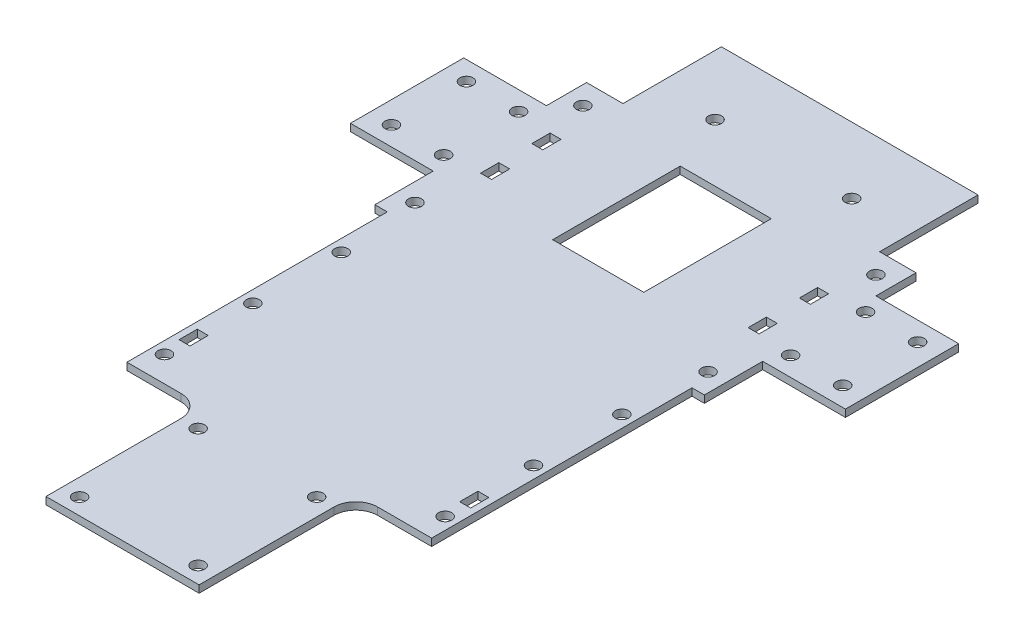
from build123d import *

# Parameters (mm, degrees)
SKETCH1_W            = 50
SKETCH1_H            = 9.1
BOSS_EXTRUDE1_DEPTH  = 2
SKETCH2_W            = 25
SKETCH2_H            = 6.6
CUT_EXTRUDE1_DEPTH   = 2
SKETCH3_R            = 1.8
CUT_EXTRUDE2_DEPTH   = 2
SKETCH4_W            = 66.4
SKETCH4_H            = 130
BOSS_EXTRUDE2_DEPTH  = 2
SKETCH5_W            = 66.4
SKETCH5_H            = 2
BOSS_EXTRUDE3_DEPTH  = 2.5
SKETCH6_W            = 8.6
SKETCH6_H            = 62.5
BOSS_EXTRUDE4_DEPTH  = 2
SKETCH7_R            = 1.8
SKETCH7_W            = 3
SKETCH7_H            = 5
CUT_EXTRUDE3_DEPTH   = 2
SKETCH8_W            = 25
SKETCH8_H            = 45
CUT_EXTRUDE4_DEPTH   = 20
SKETCH9_W            = 25
SKETCH9_H            = 10
BOSS_EXTRUDE5_DEPTH  = 2
SKETCH10_W           = 34.7
SKETCH10_H           = 27.07
BOSS_EXTRUDE6_DEPTH  = 2
SKETCH11_R           = 1.8
CUT_EXTRUDE5_DEPTH   = 2
SKETCH12_R           = 1.8
CUT_EXTRUDE6_DEPTH   = 2
SKETCH13_W           = 2
SKETCH13_H           = 2
BOSS_EXTRUDE7_DEPTH  = 44
SKETCH14_W           = 2
SKETCH14_H           = 2
BOSS_EXTRUDE8_DEPTH  = 46
SKETCH16_W           = 42
SKETCH16_H           = 43
BOSS_EXTRUDE10_DEPTH = 2
SKETCH18_R           = 1.8
CUT_EXTRUDE7_DEPTH   = 2
BOSS_EXTRUDE12_DEPTH = 2
SKETCH21_W           = 2
SKETCH21_H           = 2
BOSS_EXTRUDE13_DEPTH = 10
SKETCH25_W           = 3
SKETCH25_H           = 5
CUT_EXTRUDE8_DEPTH   = 10
SKETCH26_W           = 6.2
SKETCH26_H           = 13
SKETCH26_W_2         = 21
SKETCH26_H_2         = 6.6
BOSS_EXTRUDE14_DEPTH = 2
SKETCH27_W           = 2
SKETCH27_H           = 27
SKETCH27_H_2         = 24.93
BOSS_EXTRUDE15_DEPTH = 2
SKETCH29_W           = 10
SKETCH29_H           = 10
BOSS_EXTRUDE19_DEPTH = 2
SKETCH41_R           = 1.8
CUT_EXTRUDE15_DEPTH  = 2
BOSS_EXTRUDE26_DEPTH = 2
SKETCH43_W           = 70.4
SKETCH43_H           = 2
BOSS_EXTRUDE27_DEPTH = 11
SKETCH44_W           = 10
SKETCH44_H           = 5
BOSS_EXTRUDE28_DEPTH = 2
SKETCH45_R           = 1.8
BOSS_EXTRUDE29_DEPTH = 2
SKETCH46_R           = 1.8
CUT_EXTRUDE16_DEPTH  = 2
SKETCH47_W           = 10
SKETCH47_H           = 1
BOSS_EXTRUDE30_DEPTH = 2
SKETCH48_W           = 6.6
SKETCH48_H           = 8.93
BOSS_EXTRUDE31_DEPTH = 2


with BuildPart() as part:
    # Sketch1 → Boss-Extrude1 (new body)
    with BuildSketch(Plane(origin=(0, 0, 0), x_dir=(1, 0, 0), z_dir=(0, 1, 0))):
        with Locations((25, 4.55)):
            Rectangle(SKETCH1_W, SKETCH1_H)
    extrude(amount=BOSS_EXTRUDE1_DEPTH)

    # Sketch2 → Cut-Extrude1 (cut)
    with BuildSketch(Plane(origin=(0, 2, 0), x_dir=(1, 0, 0), z_dir=(0, 1, 0))):
        with Locations((25, 5.8)):
            Rectangle(SKETCH2_W, SKETCH2_H)
    extrude(amount=-CUT_EXTRUDE1_DEPTH, mode=Mode.SUBTRACT)

    # Sketch3 → Cut-Extrude2 (cut)
    with BuildSketch(Plane(origin=(0, 2, 0), x_dir=(1, 0, 0), z_dir=(0, 1, 0))):
        with Locations(Location((6.25, 5.8, 0), (0, 0, 270))):
            Circle(SKETCH3_R)
        with Locations(Location((43.75, 5.8, 0), (0, 0, 270))):
            Circle(SKETCH3_R)
    extrude(amount=-CUT_EXTRUDE2_DEPTH, mode=Mode.SUBTRACT)

    # Sketch4 → Boss-Extrude2 (add)
    with BuildSketch(Plane(origin=(0, 2, 0), x_dir=(1, 0, 0), z_dir=(0, 1, 0))):
        with Locations((25, -65)):
            Rectangle(SKETCH4_W, SKETCH4_H)
    extrude(amount=-BOSS_EXTRUDE2_DEPTH)

    # Sketch5 → Boss-Extrude3 (add)
    with BuildSketch(Plane.XY.offset(130)):
        with Locations((25, 1)):
            Rectangle(SKETCH5_W, SKETCH5_H)
    extrude(amount=BOSS_EXTRUDE3_DEPTH)

    # Sketch6 → Boss-Extrude4 (add)
    with BuildSketch(Plane(origin=(0, 2, 0), x_dir=(1, 0, 0), z_dir=(0, 1, 0))):
        with Locations((-12.5, -101.25)):
            Rectangle(SKETCH6_W, SKETCH6_H)
        with Locations((62.5, -101.25)):
            Rectangle(SKETCH6_W, SKETCH6_H)
    extrude(amount=-BOSS_EXTRUDE4_DEPTH)

    # Sketch7 → Cut-Extrude3 (cut)
    with BuildSketch(Plane(origin=(0, 2, 0), x_dir=(1, 0, 0), z_dir=(0, 1, 0))):
        with Locations(Location((-13.5, -77, 0), (0, 0, 270))):
            Circle(SKETCH7_R)
        with Locations(Location((-13.5, -101.25, 0), (0, 0, 270))):
            Circle(SKETCH7_R)
        with Locations(Location((-13.5, -125.5, 0), (0, 0, 270))):
            Circle(SKETCH7_R)
        with Locations(Location((63.5, -77, 0), (0, 0, 270))):
            Circle(SKETCH7_R)
        with Locations(Location((63.5, -101.25, 0), (0, 0, 270))):
            Circle(SKETCH7_R)
        with Locations(Location((63.5, -125.5, 0), (0, 0, 270))):
            Circle(SKETCH7_R)
        with Locations((-13.5, -117.5)):
            Rectangle(SKETCH7_W, SKETCH7_H)
        with Locations((63.5, -117.5)):
            Rectangle(SKETCH7_W, SKETCH7_H)
    extrude(amount=-CUT_EXTRUDE3_DEPTH, mode=Mode.SUBTRACT)

    # Sketch8 → Cut-Extrude4 (cut)
    with BuildSketch(Plane(origin=(0, 2, 0), x_dir=(1, 0, 0), z_dir=(0, 1, 0))):
        with Locations((25, -22.5)):
            Rectangle(SKETCH8_W, SKETCH8_H)
    extrude(amount=-CUT_EXTRUDE4_DEPTH, mode=Mode.SUBTRACT)

    # Sketch9 → Boss-Extrude5 (add)
    with BuildSketch(Plane(origin=(0, 2, 0), x_dir=(1, 0, 0), z_dir=(0, 1, 0))):
        with Locations((25, -5)):
            Rectangle(SKETCH9_W, SKETCH9_H)
    extrude(amount=-BOSS_EXTRUDE5_DEPTH)

    # Sketch10 → Boss-Extrude6 (add)
    with BuildSketch(Plane(origin=(0, 2, 0), x_dir=(1, 0, 0), z_dir=(0, 1, 0))):
        with Locations((-25.55, -29.535)):
            Rectangle(SKETCH10_W, SKETCH10_H)
        with Locations((75.55, -29.535)):
            Rectangle(SKETCH10_W, SKETCH10_H)
    extrude(amount=-BOSS_EXTRUDE6_DEPTH)

    # Sketch11 → Cut-Extrude5 (cut)
    with BuildSketch(Plane(origin=(0, 2, 0), x_dir=(1, 0, 0), z_dir=(0, 1, 0))):
        with Locations(Location((-36.9, -19.25, 0), (0, 0, 270))):
            Circle(SKETCH11_R)
        with Locations(Location((-36.9, -39.82, 0), (0, 0, 270))):
            Circle(SKETCH11_R)
        with Locations(Location((-22.6, -19.25, 0), (0, 0, 270))):
            Circle(SKETCH11_R)
        with Locations(Location((-22.6, -39.82, 0), (0, 0, 270))):
            Circle(SKETCH11_R)
    extrude(amount=-CUT_EXTRUDE5_DEPTH, mode=Mode.SUBTRACT)

    # Sketch12 → Cut-Extrude6 (cut)
    with BuildSketch(Plane(origin=(0, 2, 0), x_dir=(1, 0, 0), z_dir=(0, 1, 0))):
        with Locations(Location((72.6, -19.25, 0), (0, 0, 270))):
            Circle(SKETCH12_R)
        with Locations(Location((86.9, -19.25, 0), (0, 0, 270))):
            Circle(SKETCH12_R)
        with Locations(Location((72.6, -39.82, 0), (0, 0, 270))):
            Circle(SKETCH12_R)
        with Locations(Location((86.9, -39.82, 0), (0, 0, 270))):
            Circle(SKETCH12_R)
    extrude(amount=-CUT_EXTRUDE6_DEPTH, mode=Mode.SUBTRACT)

    # Sketch13 → Boss-Extrude7 (add)
    with BuildSketch(Plane.ZY.offset(42.9)):
        with Locations((15, 1)):
            Rectangle(SKETCH13_W, SKETCH13_H)
        with Locations((44.07, 1)):
            Rectangle(SKETCH13_W, SKETCH13_H)
    extrude(amount=-BOSS_EXTRUDE7_DEPTH)

    # Sketch14 → Boss-Extrude8 (add)
    with BuildSketch(Plane(origin=(92.9, 0, 0), x_dir=(0, 0, -1), z_dir=(1, 0, 0))):
        with Locations((-15, 1)):
            Rectangle(SKETCH14_W, SKETCH14_H)
        with Locations((-44.07, 1)):
            Rectangle(SKETCH14_W, SKETCH14_H)
    extrude(amount=-BOSS_EXTRUDE8_DEPTH)

    # Sketch16 → Boss-Extrude10 (add)
    with BuildSketch(Plane(origin=(0, 2, 0), x_dir=(1, 0, 0), z_dir=(0, 1, 0))):
        with Locations((25, -154)):
            Rectangle(SKETCH16_W, SKETCH16_H)
    extrude(amount=-BOSS_EXTRUDE10_DEPTH)

    # Sketch18 → Cut-Extrude7 (cut)
    with BuildSketch(Plane(origin=(0, 2, 0), x_dir=(1, 0, 0), z_dir=(0, 1, 0))):
        with Locations(Location((8.74, -171.03, 0), (0, 0, 270))):
            Circle(SKETCH18_R)
        with Locations(Location((41.26, -171.03, 0), (0, 0, 270))):
            Circle(SKETCH18_R)
        with Locations(Location((8.74, -138.5, 0), (0, 0, 270))):
            Circle(SKETCH18_R)
        with Locations(Location((41.26, -138.5, 0), (0, 0, 270))):
            Circle(SKETCH18_R)
    extrude(amount=-CUT_EXTRUDE7_DEPTH, mode=Mode.SUBTRACT)

    # Sketch20 → Boss-Extrude12 (add)
    with BuildSketch(Plane(origin=(0, 2, 0), x_dir=(1, 0, 0), z_dir=(0, 1, 0))):
        with BuildLine():
            Line((-2, -132.5), (4, -132.5))
            Line((4, -132.5), (4, -138.5))
            ThreePointArc((4, -138.5), (2.242640687, -134.257359313), (-2, -132.5))
        make_face()
        with BuildLine():
            ThreePointArc((52, -132.5), (47.757359313, -134.257359313), (46, -138.5))
            Line((46, -138.5), (46, -132.5))
            Line((46, -132.5), (52, -132.5))
        make_face()
    extrude(amount=-BOSS_EXTRUDE12_DEPTH)

    # Sketch21 → Boss-Extrude13 (add)
    with BuildSketch(Plane(origin=(0, 0, -9.1), x_dir=(-1, 0, 0), z_dir=(0, 0, -1))):
        with Locations((-51, 1)):
            Rectangle(SKETCH21_W, SKETCH21_H)
        with Locations((-36.5, 1)):
            Rectangle(SKETCH21_W, SKETCH21_H)
        with Locations((-13.5, 1)):
            Rectangle(SKETCH21_W, SKETCH21_H)
        with Locations((1, 1)):
            Rectangle(SKETCH21_W, SKETCH21_H)
    extrude(amount=-BOSS_EXTRUDE13_DEPTH)

    # Sketch25 → Cut-Extrude8 (cut)
    with BuildSketch(Plane(origin=(0, 2, 0), x_dir=(1, 0, 0), z_dir=(0, 1, 0))):
        with Locations((-11.7, -22.5)):
            Rectangle(SKETCH25_W, SKETCH25_H)
        with Locations((-11.7, -36.57)):
            Rectangle(SKETCH25_W, SKETCH25_H)
        with Locations((61.7, -22.5)):
            Rectangle(SKETCH25_W, SKETCH25_H)
        with Locations((61.7, -36.57)):
            Rectangle(SKETCH25_W, SKETCH25_H)
    extrude(amount=-CUT_EXTRUDE8_DEPTH, mode=Mode.SUBTRACT)

    # Sketch26 → Boss-Extrude14 (add)
    with BuildSketch(Plane(origin=(0, 2, 0), x_dir=(1, 0, 0), z_dir=(0, 1, 0))):
        with Locations((-5.1, 6.5)):
            Rectangle(SKETCH26_W, SKETCH26_H)
        Polygon((-2, 13), (-2, 9.1), (14.5, 9.1), (35.5, 9.1), (52, 9.1), (52, 13), align=None)
        with Locations((25, 5.8)):
            Rectangle(SKETCH26_W_2, SKETCH26_H_2)
        with Locations((55.1, 6.5)):
            Rectangle(SKETCH26_W, SKETCH26_H)
    extrude(amount=-BOSS_EXTRUDE14_DEPTH)

    # Sketch27 → Boss-Extrude15 (add)
    with BuildSketch(Plane(origin=(0, 2, 0), x_dir=(1, 0, 0), z_dir=(0, 1, 0))):
        with Locations((-9.2, -0.5)):
            Rectangle(SKETCH27_W, SKETCH27_H)
        with Locations((-9.2, -57.535)):
            Rectangle(SKETCH27_W, SKETCH27_H_2)
        with Locations((59.2, -0.5)):
            Rectangle(SKETCH27_W, SKETCH27_H)
        with Locations((59.2, -57.535)):
            Rectangle(SKETCH27_W, SKETCH27_H_2)
    extrude(amount=-BOSS_EXTRUDE15_DEPTH)

    # Sketch29 → Boss-Extrude19 (add)
    with BuildSketch(Plane(origin=(0, 2, 0), x_dir=(1, 0, 0), z_dir=(0, 1, 0))):
        with Locations((-15.2, -9)):
            Rectangle(SKETCH29_W, SKETCH29_H)
        with Locations((-15.2, -50.07)):
            Rectangle(SKETCH29_W, SKETCH29_H)
        with Locations((65.2, -9)):
            Rectangle(SKETCH29_W, SKETCH29_H)
        with Locations((65.2, -50.07)):
            Rectangle(SKETCH29_W, SKETCH29_H)
    extrude(amount=-BOSS_EXTRUDE19_DEPTH)

    # Sketch41 → Cut-Extrude15 (cut)
    with BuildSketch(Plane(origin=(0, 2, 0), x_dir=(1, 0, 0), z_dir=(0, 1, 0))):
        with Locations(Location((-15.2, -9, 0), (0, 0, 270))):
            Circle(SKETCH41_R)
        with Locations(Location((-15.2, -50.07, 0), (0, 0, 270))):
            Circle(SKETCH41_R)
        with Locations(Location((65.2, -9, 0), (0, 0, 270))):
            Circle(SKETCH41_R)
        with Locations(Location((65.2, -50.07, 0), (0, 0, 270))):
            Circle(SKETCH41_R)
    extrude(amount=-CUT_EXTRUDE15_DEPTH, mode=Mode.SUBTRACT)

    # Sketch42 → Boss-Extrude26 (add)
    with BuildSketch(Plane(origin=(0, 2, 0), x_dir=(1, 0, 0), z_dir=(0, 1, 0))):
        with BuildLine():
            Line((-16.8, -70), (-10.2, -70))
            Line((-10.2, -70), (-10.2, -63.4))
            ThreePointArc((-10.2, -63.4), (-12.133095244, -68.066904756), (-16.8, -70))
        make_face()
        with BuildLine():
            Line((60.2, -63.4), (60.2, -70))
            Line((60.2, -70), (66.8, -70))
            ThreePointArc((66.8, -70), (62.133095244, -68.066904756), (60.2, -63.4))
        make_face()
    extrude(amount=-BOSS_EXTRUDE26_DEPTH)

    # Sketch43 → Boss-Extrude27 (add)
    with BuildSketch(Plane(origin=(0, 0, -13), x_dir=(-1, 0, 0), z_dir=(0, 0, -1))):
        with Locations((-25, 1)):
            Rectangle(SKETCH43_W, SKETCH43_H)
    extrude(amount=BOSS_EXTRUDE27_DEPTH)

    # Sketch44 → Boss-Extrude28 (add)
    with BuildSketch(Plane(origin=(0, 2, 0), x_dir=(1, 0, 0), z_dir=(0, 1, 0))):
        with Locations((-15.2, -57.57)):
            Rectangle(SKETCH44_W, SKETCH44_H)
        with Locations((65.2, -57.57)):
            Rectangle(SKETCH44_W, SKETCH44_H)
    extrude(amount=-BOSS_EXTRUDE28_DEPTH)

    # Sketch45 → Boss-Extrude29 (add)
    with BuildSketch(Plane(origin=(0, 2, 0), x_dir=(1, 0, 0), z_dir=(0, 1, 0))):
        with Locations((-15.2, -50.07)):
            Circle(SKETCH45_R)
        with Locations((65.2, -50.07)):
            Circle(SKETCH45_R)
    extrude(amount=-BOSS_EXTRUDE29_DEPTH)

    # Sketch46 → Cut-Extrude16 (cut)
    with BuildSketch(Plane(origin=(0, 2, 0), x_dir=(1, 0, 0), z_dir=(0, 1, 0))):
        with Locations(Location((-15.2, -55.07, 0), (0, 0, 270))):
            Circle(SKETCH46_R)
        with Locations(Location((65.2, -55.07, 0), (0, 0, 270))):
            Circle(SKETCH46_R)
    extrude(amount=-CUT_EXTRUDE16_DEPTH, mode=Mode.SUBTRACT)

    # Sketch47 → Boss-Extrude30 (add)
    with BuildSketch(Plane(origin=(0, 2, 0), x_dir=(1, 0, 0), z_dir=(0, 1, 0))):
        with Locations((-15.2, -3.5)):
            Rectangle(SKETCH47_W, SKETCH47_H)
        with Locations((-15.2, -60.57)):
            Rectangle(SKETCH47_W, SKETCH47_H)
        with Locations((65.2, -3.5)):
            Rectangle(SKETCH47_W, SKETCH47_H)
        with Locations((65.2, -60.57)):
            Rectangle(SKETCH47_W, SKETCH47_H)
    extrude(amount=-BOSS_EXTRUDE30_DEPTH)

    # Sketch48 → Boss-Extrude31 (add)
    with BuildSketch(Plane(origin=(0, 2, 0), x_dir=(1, 0, 0), z_dir=(0, 1, 0))):
        with Locations((-13.5, -65.535)):
            Rectangle(SKETCH48_W, SKETCH48_H)
        with Locations((63.5, -65.535)):
            Rectangle(SKETCH48_W, SKETCH48_H)
    extrude(amount=-BOSS_EXTRUDE31_DEPTH)


solid = part.part
